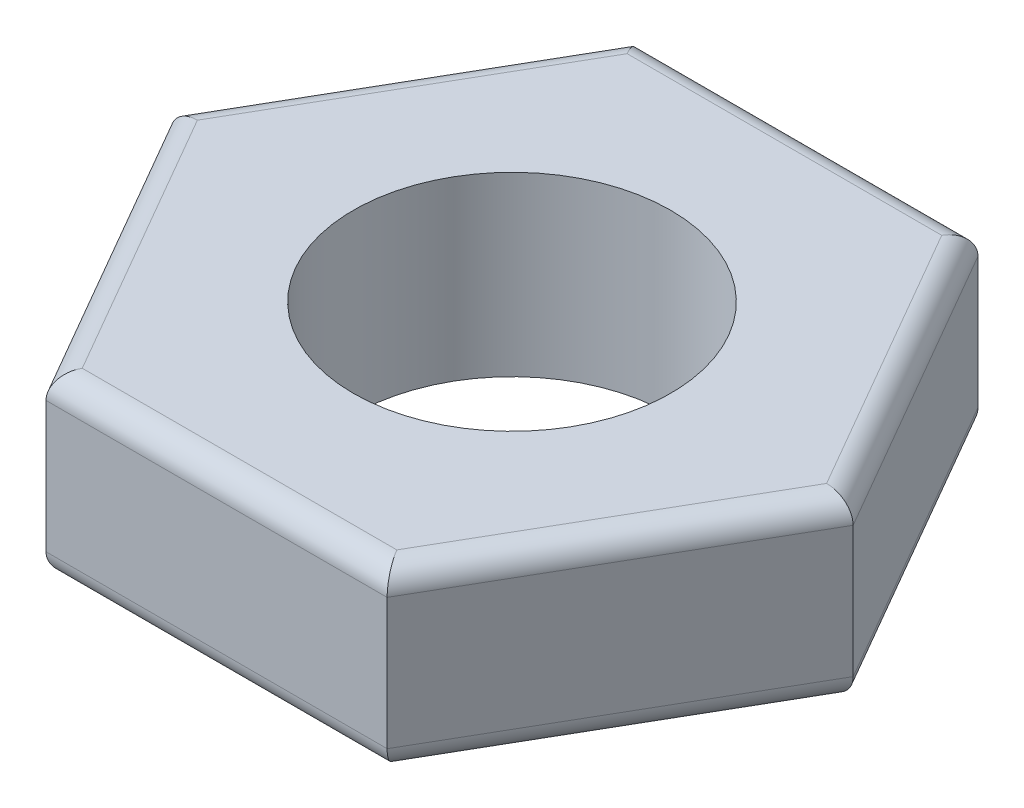
from build123d import *

# Parameters (mm, degrees)
SKETCH1_R           = 3.45
BOSS_EXTRUDE1_DEPTH = 3.85
FILLET1_R           = 0.5


with BuildPart() as part:
    # Sketch1 → Boss-Extrude1 (new body)
    with BuildSketch(Plane(origin=(0, 0, 0), x_dir=(1, 0, 0), z_dir=(0, 1, 0))):
        Polygon((7.418950959, 0), (3.70947548, 6.425), (-3.70947548, 6.425), (-7.418950959, 0), (-3.70947548, -6.425), (3.70947548, -6.425), align=None)
        with Locations(Location((0, 0, 0), (0, 0, 90))):
            Circle(SKETCH1_R, mode=Mode.SUBTRACT)
    extrude(amount=BOSS_EXTRUDE1_DEPTH)

    # Fillet1
    fillet1_edges = [part.edges().sort_by_distance(p)[0] for p in [
        (0, 3.85, -6.425),
        (-5.564213219, 3.85, -3.2125),
        (-5.564213219, 3.85, 3.2125),
        (0, 3.85, 6.425),
        (5.564213219, 3.85, 3.2125),
        (0, 0, 6.425),
        (-5.564213219, 0, 3.2125),
        (-5.564213219, 0, -3.2125),
        (0, 0, -6.425),
        (5.564213219, 0, -3.2125),
        (5.564213219, 0, 3.2125),
        (5.564213219, 3.85, -3.2125),
    ]]
    fillet(fillet1_edges, radius=FILLET1_R)


solid = part.part
